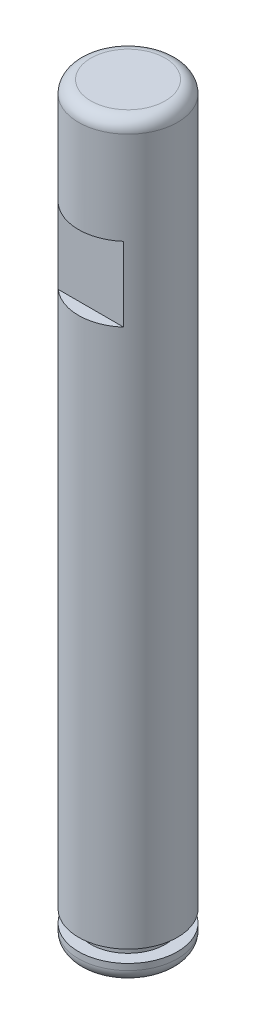
from build123d import *

# Parameters (mm, degrees)
FILLET1_R          = 0.5
CUT_EXTRUDE1_START = 1.5
SKETCH2_W          = 4
SKETCH2_H          = 3
CUT_EXTRUDE1_DEPTH = 29.881943651


with BuildPart() as part:
    # Sketch1 → Revolve1 (revolve)
    with BuildSketch(Plane.XY, mode=Mode.PRIVATE) as revolve1_sk:
        Polygon((-2, 0), (0, 0), (0, 30.25), (-2, 30.25), (-2, 1.25), (-1.5, 1.25), (-1.5, 0.75), (-2, 0.75), align=None)
    revolve(revolve1_sk.sketch.rotate(Axis((0, 0, 0), (0, 1, 0)), 270), axis=Axis((0, 0, 0), (0, 1, 0)))

    # Fillet1
    fillet1_edges = [part.edges().sort_by_distance(p)[0] for p in [
        (0, 30.25, 2),
        (0, 0, 2),
    ]]
    fillet(fillet1_edges, radius=FILLET1_R)

    # Sketch2 → Cut-Extrude1 (cut, through all)
    with BuildSketch(Plane.XY.offset(CUT_EXTRUDE1_START)):
        with Locations((0, 24.5)):
            Rectangle(SKETCH2_W, SKETCH2_H)
    extrude(amount=CUT_EXTRUDE1_DEPTH, mode=Mode.SUBTRACT)


solid = part.part
